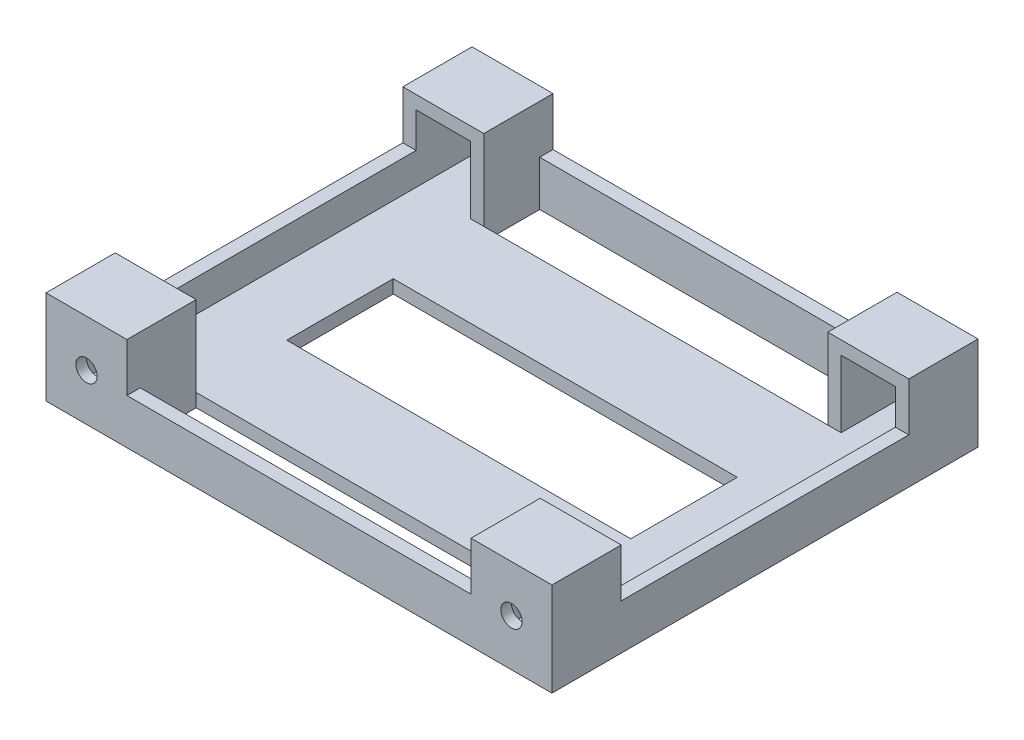
from build123d import *

# Parameters (mm, degrees)
SKETCH1_W                                  = 90
SKETCH1_H                                  = 80
BOSS_EXTRUDE1_DEPTH                        = 2.5
BOSS_EXTRUDE2_DEPTH                        = 13
SKETCH2_3_W                                = 10.2
SKETCH2_3_H                                = 12.6
SKETCH2_3_R                                = 2
BOSS_EXTRUDE3_DEPTH                        = 2
MIRROR1_AT_THE_SECOND_PLANE_COPY_1_DEPTH   = 13
MIRROR1_AT_THE_SECOND_PLANE_COPY_2_SKETC_W = 10.2
MIRROR1_AT_THE_SECOND_PLANE_COPY_2_SKETC_H = 12.6
MIRROR1_AT_THE_SECOND_PLANE_COPY_2_SKETC_R = 2
MIRROR1_AT_THE_SECOND_PLANE_COPY_2_DEPTH   = 2
BOSS_EXTRUDE4_DEPTH                        = 6
BOSS_EXTRUDE4_DEPTH_BACK                   = 2.5
SKETCH4_W                                  = 2.5
SKETCH4_H                                  = 54
SKETCH5_W                                  = 64.6
SKETCH5_H                                  = 10.5
SKETCH5_H_2                                = 20
CUT_EXTRUDE1_DEPTH                         = 64.908215434


with BuildPart() as part:
    # Sketch1 → Boss-Extrude1 (new body)
    with BuildSketch(Plane(origin=(0, 0, 0), x_dir=(1, 0, 0), z_dir=(0, 1, 0))):
        Rectangle(SKETCH1_W, SKETCH1_H)
    extrude(amount=BOSS_EXTRUDE1_DEPTH)

    # Sketch2 → Boss-Extrude2 (add)
    with BuildSketch(Plane.XY.offset(40)):
        Polygon((-45, 15.1), (-34.8, 15.1), (-34.8, 2.5), (-32.3, 2.5), (-32.3, 17.6), (-47.5, 17.6), (-47.5, 0), (-45, 0), (-45, 2.5), align=None)
    boss_extrude2 = extrude(amount=-BOSS_EXTRUDE2_DEPTH)

    # Sketch2<3> → Boss-Extrude3 (add)
    with BuildSketch(Plane.XY.offset(40)):
        with Locations((-39.9, 8.8)):
            Rectangle(SKETCH2_3_W, SKETCH2_3_H)
        with Locations((-39.9, 8.8)):
            Circle(SKETCH2_3_R, mode=Mode.SUBTRACT)
    boss_extrude3 = extrude(amount=-BOSS_EXTRUDE3_DEPTH)

    # Mirror1: Boss-Extrude2, Boss-Extrude3 across plane
    add(boss_extrude2.mirror(Plane.XY))
    add(boss_extrude3.mirror(Plane.XY))

    # Mirror1 at the second plane: Boss-Extrude2, Boss-Extrude3 across plane
    add(boss_extrude2.mirror(Plane(origin=(0, 0, 0), x_dir=(0, 0, 1), z_dir=(1, 0, 0))))
    add(boss_extrude3.mirror(Plane(origin=(0, 0, 0), x_dir=(0, 0, 1), z_dir=(1, 0, 0))))

    # Mirror1 at the second plane copy 1 sketc → Mirror1 at the second plane copy 1 (add)
    with BuildSketch(Plane(origin=(0, 0, -40), x_dir=(-1, 0, 0), z_dir=(0, 0, -1))):
        Polygon((-45, 15.1), (-34.8, 15.1), (-34.8, 2.5), (-32.3, 2.5), (-32.3, 17.6), (-47.5, 17.6), (-47.5, 0), (-45, 0), (-45, 2.5), align=None)
    extrude(amount=-MIRROR1_AT_THE_SECOND_PLANE_COPY_1_DEPTH)

    # Mirror1 at the second plane copy 2 sketc → Mirror1 at the second plane copy 2 (add)
    with BuildSketch(Plane(origin=(0, 0, -40), x_dir=(-1, 0, 0), z_dir=(0, 0, -1))):
        with Locations((-39.9, 8.8)):
            Rectangle(MIRROR1_AT_THE_SECOND_PLANE_COPY_2_SKETC_W, MIRROR1_AT_THE_SECOND_PLANE_COPY_2_SKETC_H)
        with Locations((-39.9, 8.8)):
            Circle(MIRROR1_AT_THE_SECOND_PLANE_COPY_2_SKETC_R, mode=Mode.SUBTRACT)
    extrude(amount=-MIRROR1_AT_THE_SECOND_PLANE_COPY_2_DEPTH)

    # Sketch4 → Boss-Extrude4 (add, two sides: drawn at the far end of the back side and taken through both)
    with BuildSketch(Plane(origin=(0, 2.5, 0), x_dir=(1, 0, 0), z_dir=(0, 1, 0)).offset(-BOSS_EXTRUDE4_DEPTH_BACK)):
        Polygon((32.3, 37.5), (32.3, 40), (-32.3, 40), (-32.3, 37.5), (-29.8, 37.5), (29.8, 37.5), align=None)
        Polygon((32.3, -37.5), (32.3, -40), (-32.3, -40), (-32.3, -37.5), (-29.8, -37.5), (29.8, -37.5), align=None)
        with Locations((46.25, 0)):
            Rectangle(SKETCH4_W, SKETCH4_H)
        with Locations((-46.25, 0)):
            Rectangle(SKETCH4_W, SKETCH4_H)
    extrude(amount=BOSS_EXTRUDE4_DEPTH + BOSS_EXTRUDE4_DEPTH_BACK)

    # Sketch5 → Cut-Extrude1 (cut, through all)
    with BuildSketch(Plane(origin=(0, 2.5, 0), x_dir=(1, 0, 0), z_dir=(0, 1, 0))):
        with Locations((0, -32.25)):
            Rectangle(SKETCH5_W, SKETCH5_H)
        with Locations((0, 32.25)):
            Rectangle(SKETCH5_W, SKETCH5_H)
        Rectangle(SKETCH5_W, SKETCH5_H_2)
    extrude(amount=-CUT_EXTRUDE1_DEPTH, mode=Mode.SUBTRACT)


solid = part.part
